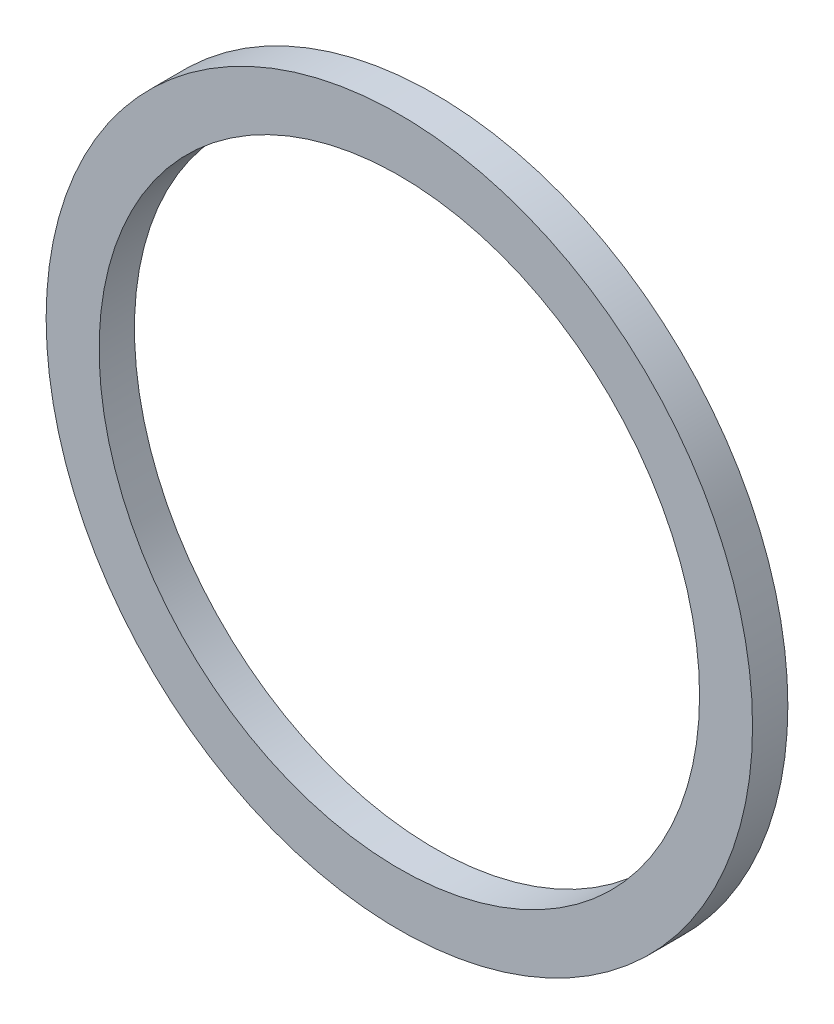
from build123d import *

# Parameters (mm, degrees)
ESQUISSE1_R        = 10
ESQUISSE1_R_2      = 8.5
BOSS_EXTRU_1_DEPTH = 1


with BuildPart() as part:
    # Esquisse1 → Boss.-Extru.1 (new body)
    with BuildSketch(Plane.XY):
        Circle(ESQUISSE1_R)
        Circle(ESQUISSE1_R_2, mode=Mode.SUBTRACT)
    extrude(amount=BOSS_EXTRU_1_DEPTH)


solid = part.part
